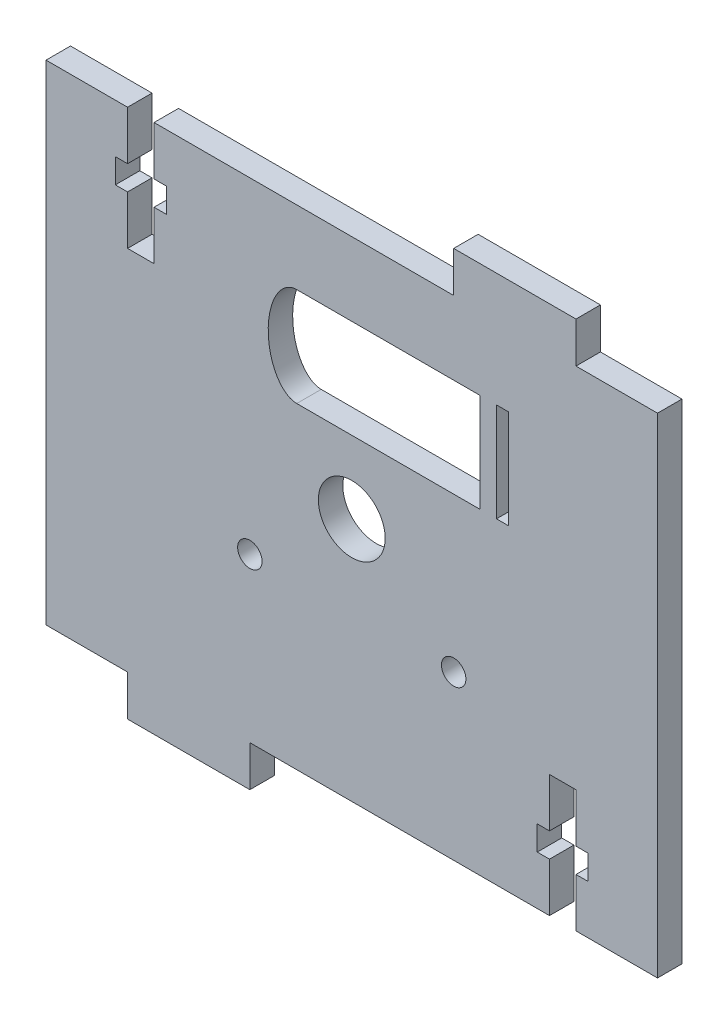
from build123d import *

# Parameters (mm, degrees)
ESQUISSE1_R        = 4.1
ESQUISSE1_R_2      = 1.5
ESQUISSE1_W        = 1.5
ESQUISSE1_H        = 12.1
BOSS_EXTRU_1_DEPTH = 3


with BuildPart() as part:
    # Esquisse1 → Boss.-Extru.1 (new body)
    with BuildSketch(Plane.XY):
        Polygon((0, 0), (10, 0), (10, -5), (25, -5), (25, 0), (61.75, 0), (61.75, 6), (60.25, 6), (60.25, 9), (61.75, 9), (61.75, 15), (65, 15), (65, 9), (66.5, 9), (66.5, 6), (65, 6), (65, 0), (75, 0), (75, 60), (65, 60), (65, 65), (50, 65), (50, 60), (13.25, 60), (13.25, 54), (14.75, 54), (14.75, 51), (13.25, 51), (13.25, 45), (10, 45), (10, 51), (8.5, 51), (8.5, 54), (10, 54), (10, 60), (0, 60), align=None)
        with Locations((37.5, 30)):
            Circle(ESQUISSE1_R, mode=Mode.SUBTRACT)
        with Locations((25, 20)):
            Circle(ESQUISSE1_R_2, mode=Mode.SUBTRACT)
        with Locations(Location((50, 20, 0), (0, 0, 180))):
            Circle(ESQUISSE1_R_2, mode=Mode.SUBTRACT)
        with BuildLine():
            Line((30.75, 38.9), (53.25, 38.9))
            Line((53.25, 38.9), (53.25, 51))
            Line((53.25, 51), (30.75, 51))
            add(Edge.make_bspline(
                [(30.75, 51), (27.25, 51), (27.25, 44.95), (27.25, 38.9), (30.75, 38.9)],
                knots=[3.141592654, 3.141592654, 3.141592654, 4.71238898, 4.71238898, 6.283185307, 6.283185307, 6.283185307], degree=2, weights=[1, 0.707106781, 1, 0.707106781, 1]))
        make_face(mode=Mode.SUBTRACT)
        with Locations((56, 44.95)):
            Rectangle(ESQUISSE1_W, ESQUISSE1_H, mode=Mode.SUBTRACT)
    extrude(amount=BOSS_EXTRU_1_DEPTH)


solid = part.part
